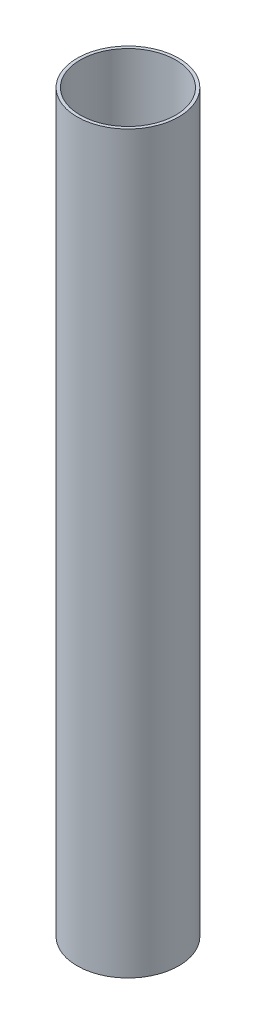
from build123d import *

# Parameters (mm, degrees)
SKETCH1_W = 3.175
SKETCH1_H = 762


with BuildPart() as part:
    # Sketch1 → Revolve1 (revolve)
    with BuildSketch(Plane.XY, mode=Mode.PRIVATE) as revolve1_sk:
        with Locations((51.1175, 381)):
            Rectangle(SKETCH1_W, SKETCH1_H)
    revolve(revolve1_sk.sketch.rotate(Axis((0, 797.913336974, 0), (0, -1, 0)), 90), axis=Axis((0, 797.913336974, 0), (0, -1, 0)))


solid = part.part
